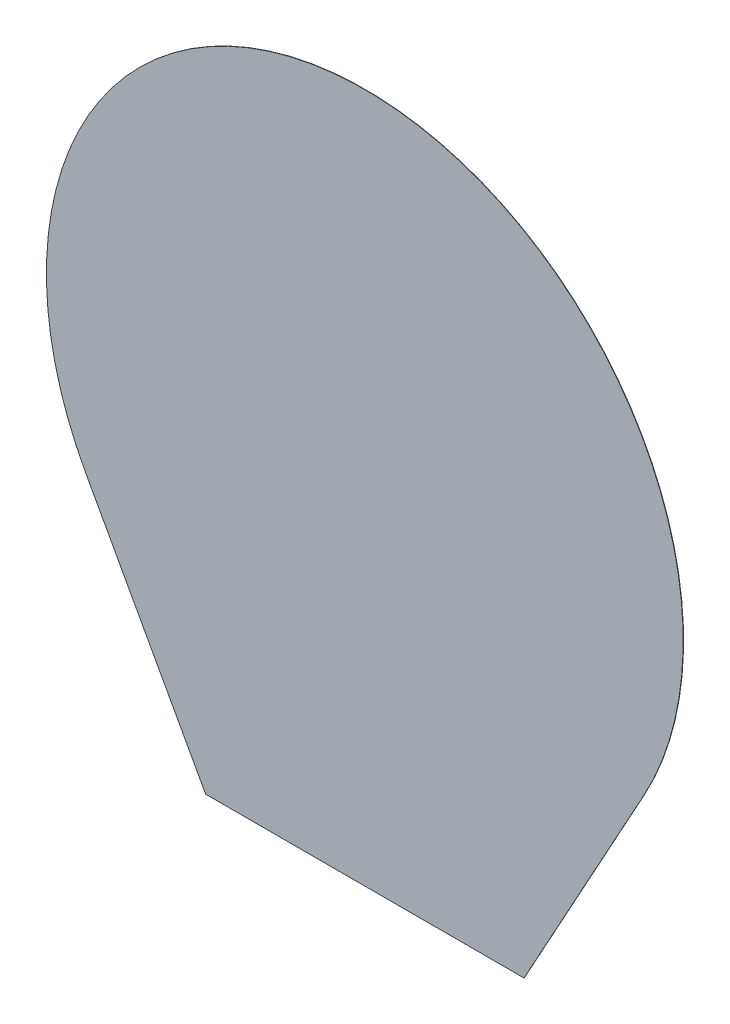
from build123d import *

# Parameters (mm, degrees)
BOSS_EXTRUDE1_DEPTH = 0.03556


with BuildPart() as part:
    # Sketch1 → Boss-Extrude1 (new body)
    with BuildSketch(Plane.XY):
        with BuildLine():
            Line((-15, -35.000000034), (15, -35.000000034))
            Line((15, -35.000000034), (26.292884658, -14.445906561))
            ThreePointArc((26.292884658, -14.445906561), (0, 30), (-26.292884658, -14.445906561))
            Line((-26.292884658, -14.445906561), (-15, -35.000000034))
        make_face()
    extrude(amount=BOSS_EXTRUDE1_DEPTH)


solid = part.part
